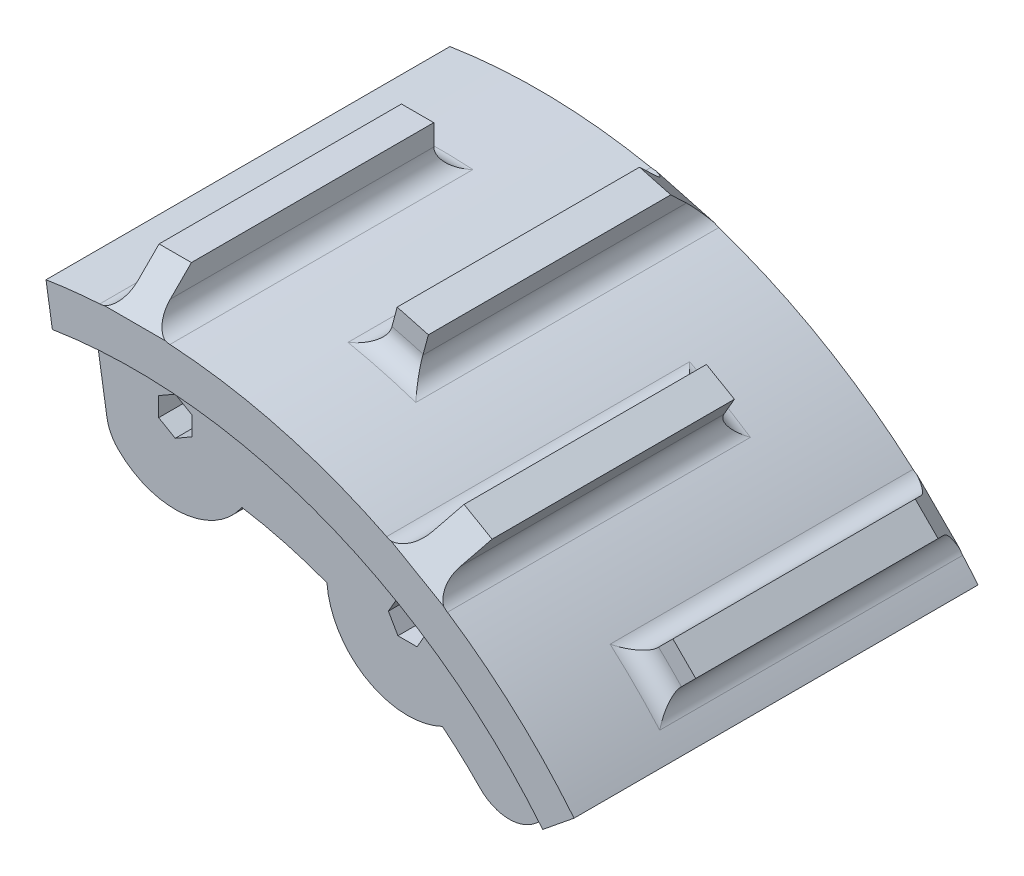
from build123d import *

# Parameters (mm, degrees)
SKETCH_1_R          = 140
EXTRUDE_1_DEPTH     = 100
SKETCH_2_R          = 105
CUT_EXTRUDE_1_DEPTH = 100
SKETCH_3_R          = 20
EXTRUDE_2_DEPTH     = 100
SKETCH_4_R          = 130
CUT_EXTRUDE_2_DEPTH = 10
CUT_EXTRUDE_START   = -10
SKETCH_5_R          = 130
CUT_EXTRUDE_3_DEPTH = 10
CUT_EXTRUDE_4_DEPTH = 218.485631709
SKETCH_7_W          = 8
SKETCH_7_H          = 10
SKETCH_7_W_2        = 10
SKETCH_7_H_2        = 8
EXTRUDE_3_DEPTH     = 70
EXTRUDE_4_DEPTH     = 70
FILLET_3_R          = 5
CHAMFER_1_SIZE      = 10
CUT_EXTRUDE_6_DEPTH = 235.447678383
FILLET_4_R          = 10


with BuildPart() as part:
    # 草图1 → 凸台-拉伸1 (new body)
    with BuildSketch(Plane.XY):
        Circle(SKETCH_1_R)
    extrude(amount=EXTRUDE_1_DEPTH)

    # 草图2 → 切除-拉伸1 (cut)
    with BuildSketch(Plane.XY.offset(100)):
        Circle(SKETCH_2_R)
    extrude(amount=-CUT_EXTRUDE_1_DEPTH, mode=Mode.SUBTRACT)

    # 草图3 → 凸台-拉伸2 (add, through all)
    with BuildSketch(Plane.XY.offset(100)):
        with Locations((0, 115)):
            Circle(SKETCH_3_R)
        with Locations((57.5, 99.592921435)):
            Circle(SKETCH_3_R)
        with Locations((99.592921435, 57.5)):
            Circle(SKETCH_3_R)
        with Locations((115, 0)):
            Circle(SKETCH_3_R)
        with Locations((99.592921435, -57.5)):
            Circle(SKETCH_3_R)
        with Locations((57.5, -99.592921435)):
            Circle(SKETCH_3_R)
        with Locations((0, -115)):
            Circle(SKETCH_3_R)
        with Locations((-57.5, -99.592921435)):
            Circle(SKETCH_3_R)
        with Locations((-99.592921435, -57.5)):
            Circle(SKETCH_3_R)
        with Locations((-115, 0)):
            Circle(SKETCH_3_R)
        with Locations((-99.592921435, 57.5)):
            Circle(SKETCH_3_R)
        with Locations((-57.5, 99.592921435)):
            Circle(SKETCH_3_R)
    extrude(amount=-EXTRUDE_2_DEPTH)

    # 草图4 → 切除-拉伸2 (cut)
    with BuildSketch(Plane.XY.offset(100)):
        Circle(SKETCH_4_R)
    extrude(amount=-CUT_EXTRUDE_2_DEPTH, mode=Mode.SUBTRACT)

    # 草图5 → 切除-拉伸3 (cut)
    with BuildSketch(Plane(origin=(0, 0, 0), x_dir=(-1, 0, 0), z_dir=(0, 0, -1)).offset(CUT_EXTRUDE_START)):
        with Locations(Location((0, 0, 0), (0, 0, 180))):
            Circle(SKETCH_5_R)
    extrude(amount=CUT_EXTRUDE_3_DEPTH, mode=Mode.SUBTRACT)

    # 草图6 → 切除-拉伸4 (cut, through all)
    with BuildSketch(Plane.XY.offset(90)):
        Polygon((55.132863896, 95.492921435), (59.867136104, 95.492921435), (62.234272207, 99.592921435), (59.867136104, 103.692921435), (55.132863896, 103.692921435), (52.765727793, 99.592921435), align=None)
        Polygon((0, 110.265727793), (4.1, 112.632863896), (4.1, 117.367136104), (0, 119.734272207), (-4.1, 117.367136104), (-4.1, 112.632863896), align=None)
        Polygon((95.492921435, 55.132863896), (99.592921435, 52.765727793), (103.692921435, 55.132863896), (103.692921435, 59.867136104), (99.592921435, 62.234272207), (95.492921435, 59.867136104), align=None)
        Polygon((110.265727793, 0), (112.632863896, -4.1), (117.367136104, -4.1), (119.734272207, 0), (117.367136104, 4.1), (112.632863896, 4.1), align=None)
        Polygon((95.492921435, -55.132863896), (95.492921435, -59.867136104), (99.592921435, -62.234272207), (103.692921435, -59.867136104), (103.692921435, -55.132863896), (99.592921435, -52.765727793), align=None)
        Polygon((55.132863896, -95.492921435), (52.765727793, -99.592921435), (55.132863896, -103.692921435), (59.867136104, -103.692921435), (62.234272207, -99.592921435), (59.867136104, -95.492921435), align=None)
        Polygon((0, -110.265727793), (-4.1, -112.632863896), (-4.1, -117.367136104), (0, -119.734272207), (4.1, -117.367136104), (4.1, -112.632863896), align=None)
        Polygon((-55.132863896, -95.492921435), (-59.867136104, -95.492921435), (-62.234272207, -99.592921435), (-59.867136104, -103.692921435), (-55.132863896, -103.692921435), (-52.765727793, -99.592921435), align=None)
        Polygon((-95.492921435, -55.132863896), (-99.592921435, -52.765727793), (-103.692921435, -55.132863896), (-103.692921435, -59.867136104), (-99.592921435, -62.234272207), (-95.492921435, -59.867136104), align=None)
        Polygon((-110.265727793, 0), (-112.632863896, 4.1), (-117.367136104, 4.1), (-119.734272207, 0), (-117.367136104, -4.1), (-112.632863896, -4.1), align=None)
        Polygon((-95.492921435, 55.132863896), (-95.492921435, 59.867136104), (-99.592921435, 62.234272207), (-103.692921435, 59.867136104), (-103.692921435, 55.132863896), (-99.592921435, 52.765727793), align=None)
        Polygon((-55.132863896, 95.492921435), (-52.765727793, 99.592921435), (-55.132863896, 103.692921435), (-59.867136104, 103.692921435), (-62.234272207, 99.592921435), (-59.867136104, 95.492921435), align=None)
    extrude(amount=-CUT_EXTRUDE_4_DEPTH, mode=Mode.SUBTRACT)

    # 草图7 → 凸台-拉伸3 (add)
    with BuildSketch(Plane.XY.offset(100)):
        Polygon((66.507321123, 123.19405926), (73.435524353, 119.19405926), (78.435524353, 127.854313298), (71.507321123, 131.854313298), align=None)
        with Locations((0, 144.942845476)):
            Rectangle(SKETCH_7_W, SKETCH_7_H)
        Polygon((119.19405926, 73.435524353), (123.19405926, 66.507321123), (131.854313298, 71.507321123), (127.854313298, 78.435524353), align=None)
        with Locations((144.942845476, 0)):
            Rectangle(SKETCH_7_W_2, SKETCH_7_H_2)
        Polygon((123.19405926, -66.507321123), (119.19405926, -73.435524353), (127.854313298, -78.435524353), (131.854313298, -71.507321123), align=None)
        Polygon((73.435524353, -119.19405926), (66.507321123, -123.19405926), (71.507321123, -131.854313298), (78.435524353, -127.854313298), align=None)
        with Locations((0, -144.942845476)):
            Rectangle(SKETCH_7_W, SKETCH_7_H)
        Polygon((-66.507321123, -123.19405926), (-73.435524353, -119.19405926), (-78.435524353, -127.854313298), (-71.507321123, -131.854313298), align=None)
        Polygon((-119.19405926, -73.435524353), (-123.19405926, -66.507321123), (-131.854313298, -71.507321123), (-127.854313298, -78.435524353), align=None)
        with Locations((-144.942845476, 0)):
            Rectangle(SKETCH_7_W_2, SKETCH_7_H_2)
        Polygon((-123.19405926, 66.507321123), (-119.19405926, 73.435524353), (-127.854313298, 78.435524353), (-131.854313298, 71.507321123), align=None)
        Polygon((-73.435524353, 119.19405926), (-66.507321123, 123.19405926), (-71.507321123, 131.854313298), (-78.435524353, 127.854313298), align=None)
    extrude(amount=-EXTRUDE_3_DEPTH)

    # 草图9 → 凸台-拉伸4 (add)
    with BuildSketch(Plane(origin=(0, 0, 0), x_dir=(-1, 0, 0), z_dir=(0, 0, -1))):
        Polygon((34.944360781, 145.868943093), (32.35617033, 136.20968483), (40.08357694, 134.13913247), (42.671767391, 143.798390732), align=None)
        Polygon((101.78296214, 96.12610789), (108.854029951, 103.197175702), (103.197175702, 108.854029951), (96.12610789, 101.78296214), align=None)
        Polygon((136.20968483, 32.35617033), (145.868943093, 34.944360781), (143.798390732, 42.671767391), (134.13913247, 40.08357694), align=None)
        Polygon((134.13913247, -40.08357694), (143.798390732, -42.671767391), (145.868943093, -34.944360781), (136.20968483, -32.35617033), align=None)
        Polygon((96.12610789, -101.78296214), (103.197175702, -108.854029951), (108.854029951, -103.197175702), (101.78296214, -96.12610789), align=None)
        Polygon((32.35617033, -136.20968483), (34.944360781, -145.868943093), (42.671767391, -143.798390732), (40.08357694, -134.13913247), align=None)
        Polygon((-40.08357694, -134.13913247), (-42.671767391, -143.798390732), (-34.944360781, -145.868943093), (-32.35617033, -136.20968483), align=None)
        Polygon((-101.78296214, -96.12610789), (-108.854029951, -103.197175702), (-103.197175702, -108.854029951), (-96.12610789, -101.78296214), align=None)
        Polygon((-136.20968483, -32.35617033), (-145.868943093, -34.944360781), (-143.798390732, -42.671767391), (-134.13913247, -40.08357694), align=None)
        Polygon((-134.13913247, 40.08357694), (-143.798390732, 42.671767391), (-145.868943093, 34.944360781), (-136.20968483, 32.35617033), align=None)
        Polygon((-96.12610789, 101.78296214), (-103.197175702, 108.854029951), (-108.854029951, 103.197175702), (-101.78296214, 96.12610789), align=None)
        Polygon((-32.35617033, 136.20968483), (-34.944360781, 145.868943093), (-42.671767391, 143.798390732), (-40.08357694, 134.13913247), align=None)
    extrude(amount=-EXTRUDE_4_DEPTH)

    # 圆角3
    fillet_3_edges = [part.edges().sort_by_distance(p)[0] for p in [
        (70, 121.24355653, 30),
        (-70, 121.24355653, 30),
        (-121.24355653, 70, 30),
        (-140, 0, 30),
        (0, 140, 30),
        (121.24355653, 70, 30),
        (139.98571064, 2.000204155, 30),
        (121.24355653, -70, 30),
        (70, -121.24355653, 30),
        (0, -140, 30),
        (-70, -121.24355653, 30),
        (-121.24355653, -70, 30),
        (-119.19405926, -73.435524353, 65),
        (-123.19405926, -66.507321123, 65),
        (-66.507321123, -123.19405926, 65),
        (-73.435524353, -119.19405926, 65),
        (4, -139.942845476, 65),
        (-4, -139.942845476, 65),
        (73.435524353, -119.19405926, 65),
        (66.507321123, -123.19405926, 65),
        (123.19405926, -66.507321123, 65),
        (119.19405926, -73.435524353, 65),
        (139.942845476, 4, 65),
        (139.942845476, -4, 65),
        (119.19405926, 73.435524353, 65),
        (123.19405926, 66.507321123, 65),
        (-4, 139.942845476, 65),
        (4, 139.942845476, 65),
        (-139.942845476, -4, 65),
        (-139.942845476, 4, 65),
        (-123.19405926, 66.507321123, 65),
        (-119.19405926, 73.435524353, 65),
        (-73.435524353, 119.19405926, 65),
        (-66.507321123, 123.19405926, 65),
        (66.507321123, 123.19405926, 65),
        (73.435524353, 119.19405926, 65),
        (-36.234666314, 135.22961568, 70),
        (36.234666314, 135.22961568, 70),
        (98.994949366, 98.994949366, 70),
        (135.22961568, 36.234666314, 70),
        (135.22961568, -36.234666314, 70),
        (98.994949366, -98.994949366, 70),
        (36.234666314, -135.22961568, 70),
        (-36.234666314, -135.22961568, 70),
        (-98.994949366, -98.994949366, 70),
        (-135.22961568, -36.234666314, 70),
        (-135.22961568, 36.234666314, 70),
        (-98.994949366, 98.994949366, 70),
        (-96.12610789, 101.78296214, 35),
        (-101.78296214, 96.12610789, 35),
        (-134.13913247, 40.08357694, 35),
        (-136.20968483, 32.35617033, 35),
        (-136.20968483, -32.35617033, 35),
        (-134.13913247, -40.08357694, 35),
        (-101.78296214, -96.12610789, 35),
        (-96.12610789, -101.78296214, 35),
        (-40.08357694, -134.13913247, 35),
        (-32.35617033, -136.20968483, 35),
        (32.35617033, -136.20968483, 35),
        (40.08357694, -134.13913247, 35),
        (96.12610789, -101.78296214, 35),
        (101.78296214, -96.12610789, 35),
        (134.13913247, -40.08357694, 35),
        (136.20968483, -32.35617033, 35),
        (136.20968483, 32.35617033, 35),
        (134.13913247, 40.08357694, 35),
        (101.78296214, 96.12610789, 35),
        (96.12610789, 101.78296214, 35),
        (40.08357694, 134.13913247, 35),
        (32.35617033, 136.20968483, 35),
        (-40.08357694, 134.13913247, 35),
        (-32.35617033, 136.20968483, 35),
    ]]
    fillet(fillet_3_edges, radius=FILLET_3_R)

    # 倒角1
    chamfer_1_edges = [part.edges().sort_by_distance(p)[0] for p in [
        (74.971422738, 129.854313298, 100),
        (106.025602827, 106.025602827, 0),
        (129.854313298, 74.971422738, 100),
        (144.833666913, 38.808064086, 0),
        (149.942845476, 0, 100),
        (144.833666913, -38.808064086, 0),
        (129.854313298, -74.971422738, 100),
        (106.025602827, -106.025602827, 0),
        (74.971422738, -129.854313298, 100),
        (38.808064086, -144.833666913, 0),
        (0, -149.942845476, 100),
        (-38.808064086, -144.833666913, 0),
        (-74.971422738, -129.854313298, 100),
        (-106.025602827, -106.025602827, 0),
        (-129.854313298, -74.971422738, 100),
        (-144.833666913, -38.808064086, 0),
        (-149.942845476, 0, 100),
        (-129.854313298, 74.971422738, 100),
        (-74.971422738, 129.854313298, 100),
        (0, 149.942845476, 100),
        (-144.833666913, 38.808064086, 0),
        (-106.025602827, 106.025602827, 0),
        (-38.808064086, 144.833666913, 0),
        (38.808064086, 144.833666913, 0),
    ]]
    chamfer(chamfer_1_edges, length=CHAMFER_1_SIZE)

    # 草图10 → 切除-拉伸6 (cut, through all)
    with BuildSketch(Plane(origin=(0, 0, 0), x_dir=(-1, 0, 0), z_dir=(0, 0, -1))):
        with BuildLine():
            Line((0, 0), (25.926748518, 162.950310559))
            ThreePointArc((25.926748518, 162.950310559), (59.021932425, -154.082482758), (-128.15573424, 103.928378134))
            Line((-128.15573424, 103.928378134), (0, 0))
        make_face()
    extrude(amount=-CUT_EXTRUDE_6_DEPTH, mode=Mode.SUBTRACT)

    # 圆角4
    fillet_4_edges = [part.edges().sort_by_distance(p)[0] for p in [
        (81.553649062, 66.136240631, 50),
        (-16.498839966, 103.695652174, 50),
    ]]
    fillet(fillet_4_edges, radius=FILLET_4_R)


solid = part.part
